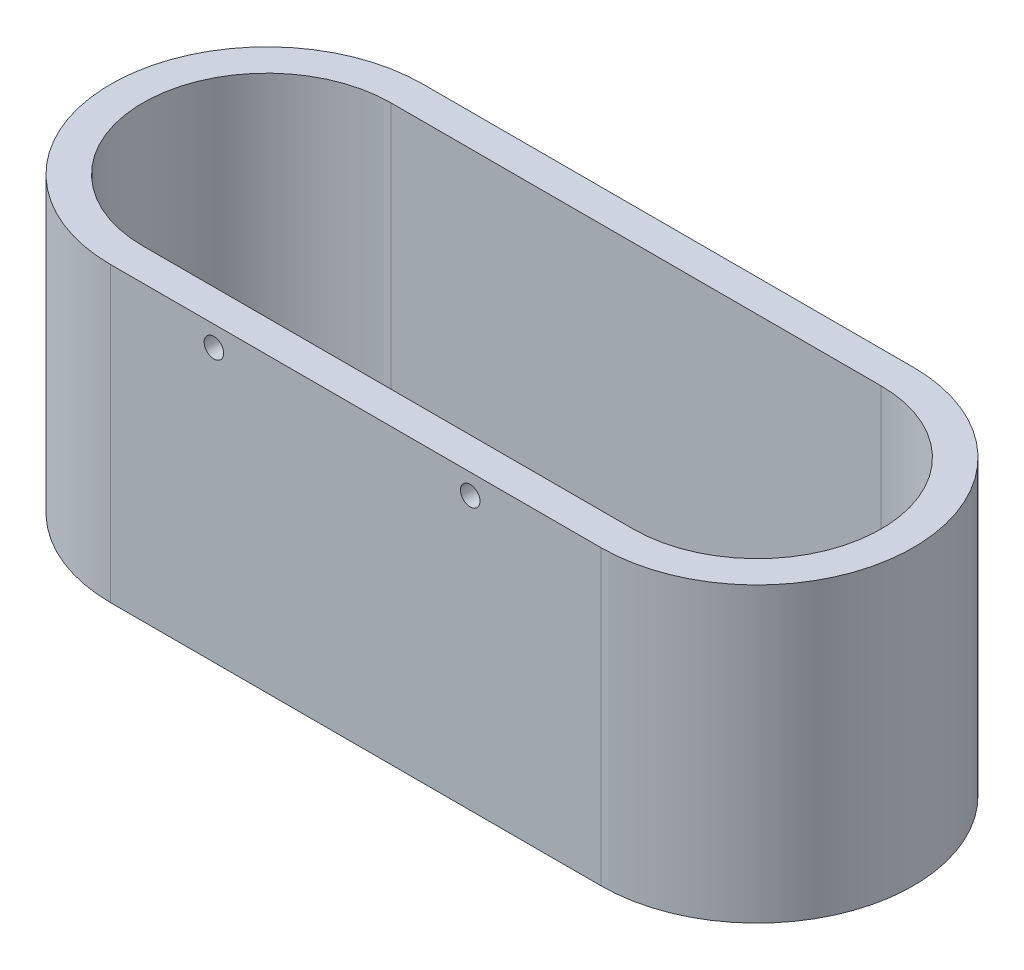
from build123d import *

# Parameters (mm, degrees)
BOSS_EXTRUDE1_DEPTH = 30
CUT_EXTRUDE1_REACH  = 62.617
SKETCH2_R           = 1


with BuildPart() as part:
    # Sketch1 → Boss-Extrude1 (new body)
    with BuildSketch(Plane(origin=(0, 0, 0), x_dir=(1, 0, 0), z_dir=(0, 1, 0))):
        with BuildLine():
            ThreePointArc((24.385224347, -16), (40.385224347, 0), (24.385224347, 16))
            Line((24.385224347, 16), (-25.838160871, 16))
            ThreePointArc((-25.838160871, 16), (-41.838160871, 0), (-25.838160871, -16))
            Line((-25.838160871, -16), (24.385224347, -16))
        make_face()
        with BuildLine():
            ThreePointArc((-25.838160871, -12.7), (-38.538160871, 0), (-25.838160871, 12.7))
            Line((-25.838160871, 12.7), (24.385224347, 12.7))
            ThreePointArc((24.385224347, 12.7), (37.085224347, 0), (24.385224347, -12.7))
            Line((24.385224347, -12.7), (-25.838160871, -12.7))
        make_face(mode=Mode.SUBTRACT)
    extrude(amount=BOSS_EXTRUDE1_DEPTH)

    # Sketch2 → Cut-Extrude1 (cut, up to next)
    with BuildSketch(Plane.XY.offset(16), mode=Mode.PRIVATE) as cut_extrude1_sk1:
        with Locations((-15.261305548, 27.914958552)):
            Circle(SKETCH2_R)
    cut_extrude1_tool1 = extrude(cut_extrude1_sk1.sketch, amount=-CUT_EXTRUDE1_REACH, mode=Mode.PRIVATE) & part.part
    # Sketch2 → Cut-Extrude1 (cut, up to next)
    with BuildSketch(Plane.XY.offset(16), mode=Mode.PRIVATE) as cut_extrude1_sk2:
        with Locations((10.996521588, 27.914958552)):
            Circle(SKETCH2_R)
    cut_extrude1_tool2 = extrude(cut_extrude1_sk2.sketch, amount=-CUT_EXTRUDE1_REACH, mode=Mode.PRIVATE) & part.part
    add(cut_extrude1_tool1.solids().sort_by_distance((-15.261306, 27.914959, 16))[0], mode=Mode.SUBTRACT)
    add(cut_extrude1_tool2.solids().sort_by_distance((10.996522, 27.914959, 16))[0], mode=Mode.SUBTRACT)


solid = part.part
